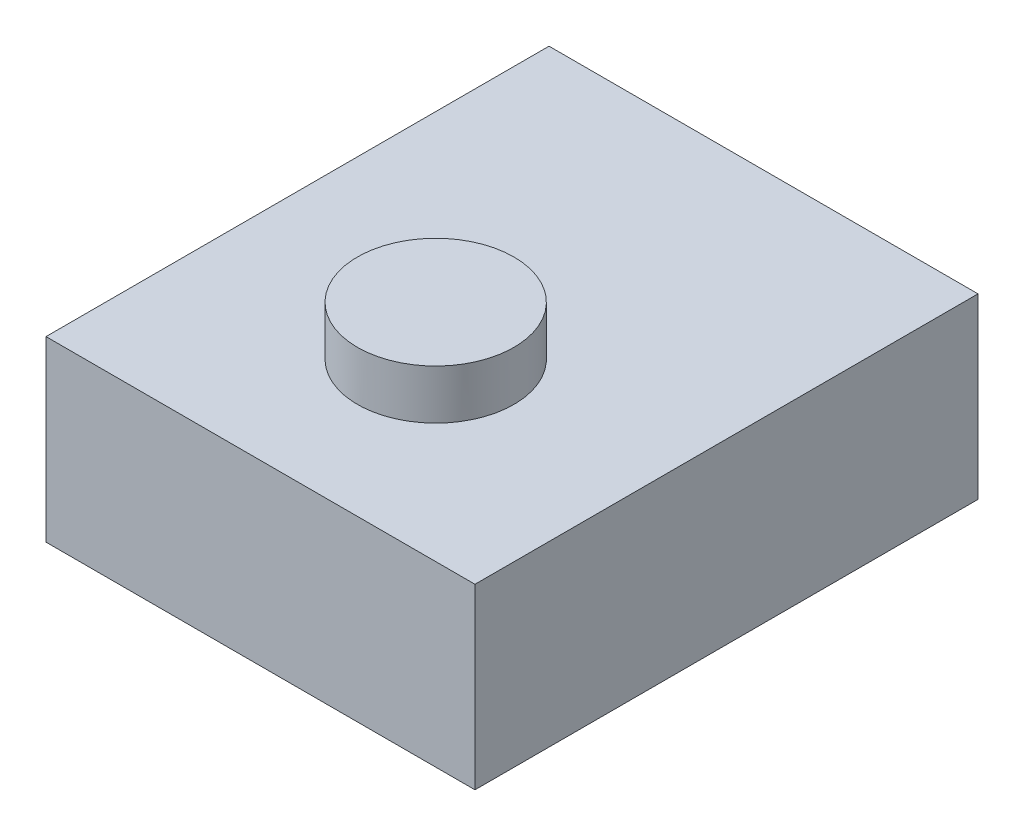
from build123d import *

# Parameters (mm, degrees)
SKETCH2_W           = 15.18
SKETCH2_H           = 17.8
BOSS_EXTRUDE1_DEPTH = 6.3
SKETCH3_R           = 2.77
BOSS_EXTRUDE2_DEPTH = 1.75


with BuildPart() as part:
    # Sketch2 → Boss-Extrude1 (new body)
    with BuildSketch(Plane(origin=(0, 0, 0), x_dir=(1, 0, 0), z_dir=(0, 1, 0))):
        with Locations((7.59, 8.9)):
            Rectangle(SKETCH2_W, SKETCH2_H)
    extrude(amount=BOSS_EXTRUDE1_DEPTH)

    # Sketch3 → Boss-Extrude2 (add)
    with BuildSketch(Plane(origin=(0, 6.3, 0), x_dir=(1, 0, 0), z_dir=(0, 1, 0))):
        with Locations(Location((7.59, 6.2, 0), (0, 0, 90))):
            Circle(SKETCH3_R)
    extrude(amount=BOSS_EXTRUDE2_DEPTH)


solid = part.part
